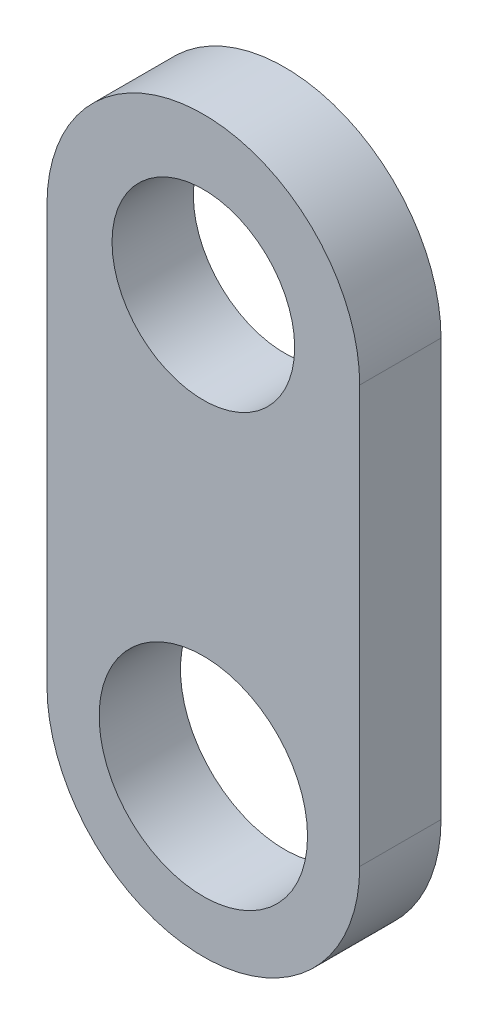
from build123d import *

# Parameters (mm, degrees)
SKETCH2_R           = 11.1252
SKETCH2_R_2         = 12.69365
BOSS_EXTRUDE1_DEPTH = 4.953


with BuildPart() as part:
    # Sketch2 → Boss-Extrude1 (new, symmetric)
    with BuildSketch(Plane.XY):
        with BuildLine():
            Line((-19.05, 0), (-19.05, 50.8))
            ThreePointArc((-19.05, 50.8), (0, 69.85), (19.05, 50.8))
            Line((19.05, 50.8), (19.05, 0))
            ThreePointArc((19.05, 0), (0, -19.05), (-19.05, 0))
        make_face()
        with Locations((0, 50.8)):
            Circle(SKETCH2_R, mode=Mode.SUBTRACT)
        Circle(SKETCH2_R_2, mode=Mode.SUBTRACT)
    extrude(amount=BOSS_EXTRUDE1_DEPTH, both=True)


solid = part.part
